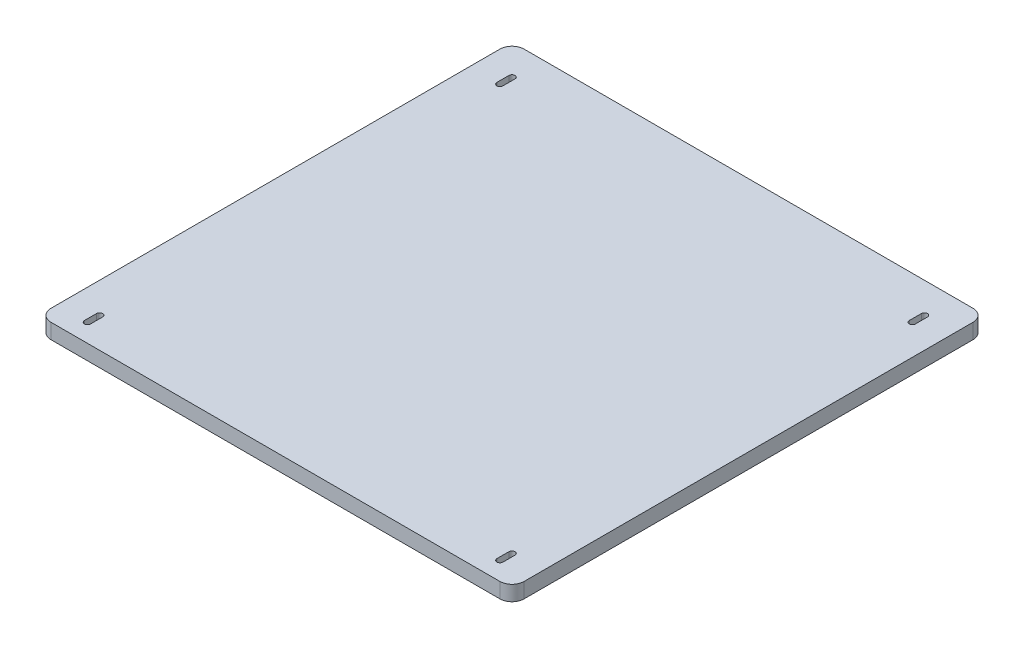
from build123d import *

# Parameters (mm, degrees)
BOSS_EXTRUDE1_DEPTH = 12.7


with BuildPart() as part:
    # Sketch1 → Boss-Extrude1 (new body)
    with BuildSketch(Plane(origin=(0, 0, 0), x_dir=(1, 0, 0), z_dir=(0, 1, 0))):
        with BuildLine():
            Line((-188.341, 198.501), (188.341, 198.501))
            ThreePointArc((188.341, 198.501), (195.525204897, 195.525204897), (198.501, 188.341))
            Line((198.501, 188.341), (198.501, -188.341))
            ThreePointArc((198.501, -188.341), (195.525204897, -195.525204897), (188.341, -198.501))
            Line((188.341, -198.501), (-188.341, -198.501))
            ThreePointArc((-188.341, -198.501), (-195.525204897, -195.525204897), (-198.501, -188.341))
            Line((-198.501, -188.341), (-198.501, 188.341))
            ThreePointArc((-198.501, 188.341), (-195.525204897, 195.525204897), (-188.341, 198.501))
        make_face()
        with BuildLine():
            Line((-170.4975, 173.0375), (-170.4975, 162.8775))
            ThreePointArc((-170.4975, 162.8775), (-173.0375, 160.3375), (-175.5775, 162.8775))
            Line((-175.5775, 162.8775), (-175.5775, 173.0375))
            ThreePointArc((-175.5775, 173.0375), (-173.0375, 175.5775), (-170.4975, 173.0375))
        make_face(mode=Mode.SUBTRACT)
        with BuildLine():
            Line((175.5775, 173.0375), (175.5775, 162.8775))
            ThreePointArc((175.5775, 162.8775), (173.0375, 160.3375), (170.4975, 162.8775))
            Line((170.4975, 162.8775), (170.4975, 173.0375))
            ThreePointArc((170.4975, 173.0375), (173.0375, 175.5775), (175.5775, 173.0375))
        make_face(mode=Mode.SUBTRACT)
        with BuildLine():
            Line((-170.4975, -173.0375), (-170.4975, -183.1975))
            ThreePointArc((-170.4975, -183.1975), (-173.0375, -185.7375), (-175.5775, -183.1975))
            Line((-175.5775, -183.1975), (-175.5775, -173.0375))
            ThreePointArc((-175.5775, -173.0375), (-173.0375, -170.4975), (-170.4975, -173.0375))
        make_face(mode=Mode.SUBTRACT)
        with BuildLine():
            Line((175.5775, -173.0375), (175.5775, -183.1975))
            ThreePointArc((175.5775, -183.1975), (173.0375, -185.7375), (170.4975, -183.1975))
            Line((170.4975, -183.1975), (170.4975, -173.0375))
            ThreePointArc((170.4975, -173.0375), (173.0375, -170.4975), (175.5775, -173.0375))
        make_face(mode=Mode.SUBTRACT)
    extrude(amount=BOSS_EXTRUDE1_DEPTH)


solid = part.part
